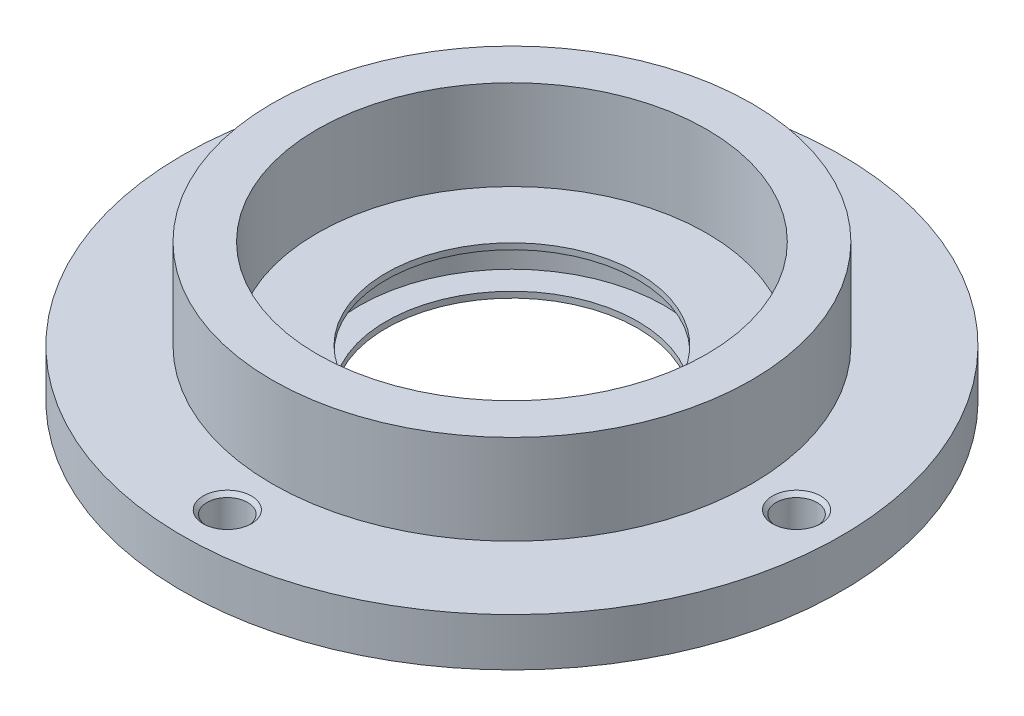
from build123d import *

# Parameters (mm, degrees)
HOLE_WIZARD_M8_1_D           = 6.8
HOLE_WIZARD_M8_1_CSINK_D     = 8.05
HOLE_WIZARD_M8_1_CSINK_ANGLE = 90
SKETCH_3_R                   = 21
CUT_EXTRUDE_3_DEPTH          = 21


with BuildPart() as part:
    # 草图1 → 旋转1 (revolve)
    with BuildSketch(Plane.XY, mode=Mode.PRIVATE) as revolve_1_sk:
        Polygon((0, 0), (55, 0), (55, 8), (40, 8), (40, 23), (32.5, 23), (32.5, 8), (0, 8), align=None)
    revolve(revolve_1_sk.sketch.rotate(Axis((0, 8, 0), (0, -1, 0)), 180), axis=Axis((0, 8, 0), (0, -1, 0)))

    # M8 螺纹孔1 (through all)
    with Locations(Plane(origin=(0, 8, 0), x_dir=(1, 0, 0), z_dir=(0, 1, 0))):
        with Locations((-47.5, 0), (47.5, 0), (0, -47.5), (0, 47.5)):
            CounterSinkHole(HOLE_WIZARD_M8_1_D / 2, HOLE_WIZARD_M8_1_CSINK_D / 2, counter_sink_angle=HOLE_WIZARD_M8_1_CSINK_ANGLE)

    # 草图3 → 切除-拉伸3 (cut)
    with BuildSketch(Plane(origin=(0, 0, 0), x_dir=(1, 0, 0), z_dir=(0, 1, 0))):
        Circle(SKETCH_3_R)
    extrude(amount=CUT_EXTRUDE_3_DEPTH, mode=Mode.SUBTRACT)

    # 草图4 → 切除-旋转2 (revolve, cut)
    with BuildSketch(Plane(origin=(0, 0, 0), x_dir=(0, 0, -1), z_dir=(1, 0, 0))):
        Polygon((10.5, 7), (10.5, 1), (21, 1), (25.5, 1), (25.5, 4), (25.5, 7), (21, 7), align=None)
    revolve(axis=Axis((0, 0, 0), (0, 1, 0)), mode=Mode.SUBTRACT)


solid = part.part
